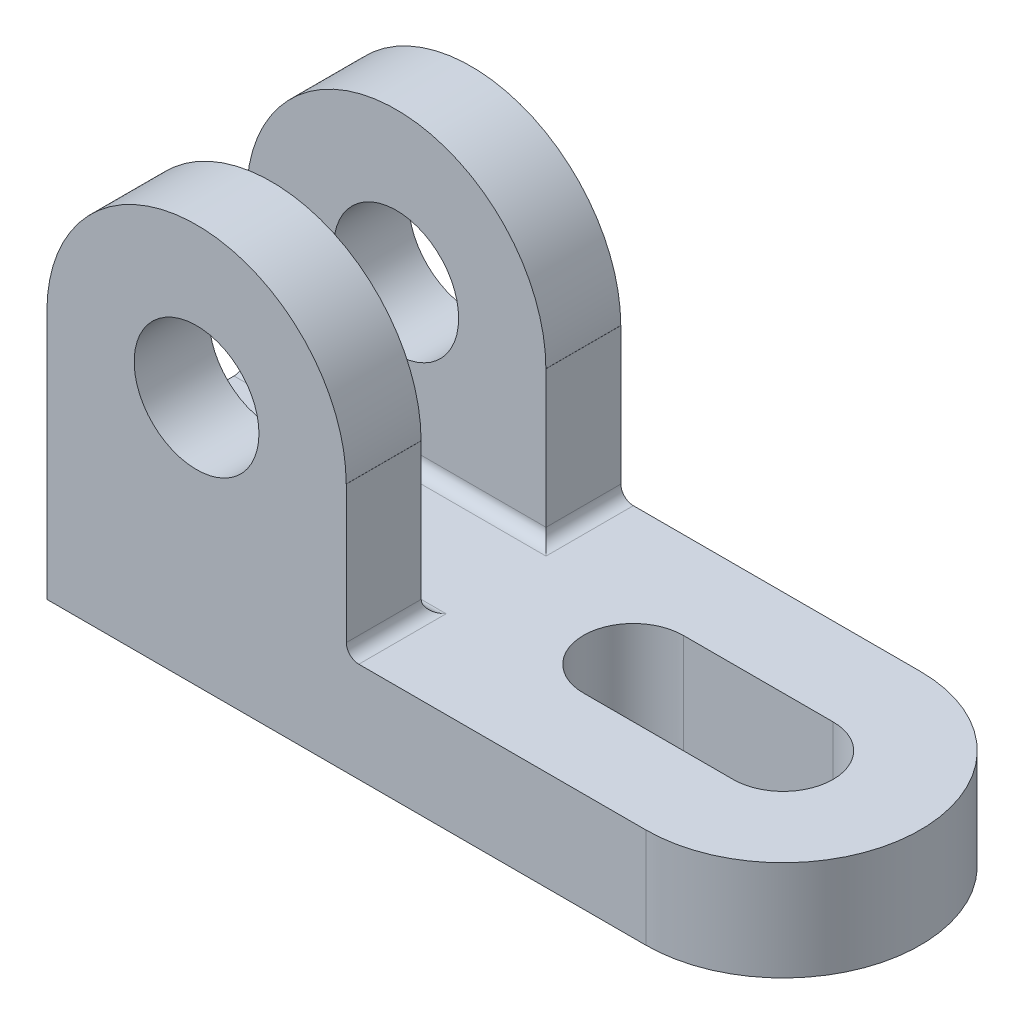
from build123d import *

# Parameters (mm, degrees)
SKETCH3_R           = 22
BOSS_EXTRUDE1_DEPTH = 16
CUT_EXTRUDE1_DEPTH  = 16
BOSS_EXTRUDE2_DEPTH = 12
FILLET1_R           = 2


with BuildPart() as part:
    # Sketch3 → Boss-Extrude1 (new body)
    with BuildSketch(Plane(origin=(0, 0, 0), x_dir=(1, 0, 0), z_dir=(0, 1, 0))):
        with BuildLine():
            Line((-59, -22), (37, -22))
            ThreePointArc((37, -22), (15, 0), (37, 22))
            Line((37, 22), (-59, 22))
            Line((-59, 22), (-59, -22))
        make_face()
        with Locations((37, 0)):
            Circle(SKETCH3_R)
    extrude(amount=BOSS_EXTRUDE1_DEPTH)

    # Sketch4 → Cut-Extrude1 (cut)
    with BuildSketch(Plane(origin=(0, 16, 0), x_dir=(1, 0, 0), z_dir=(0, 1, 0))):
        with BuildLine():
            Line((37, -8), (13, -8))
            ThreePointArc((13, -8), (5, 0), (13, 8))
            Line((13, 8), (37, 8))
            ThreePointArc((37, 8), (45, 0), (37, -8))
        make_face()
    extrude(amount=-CUT_EXTRUDE1_DEPTH, mode=Mode.SUBTRACT)

    # Sketch5 → Boss-Extrude2 (add)
    with BuildSketch(Plane.XY.offset(22)):
        with BuildLine():
            Line((-59, 40), (-59, 16))
            Line((-59, 16), (-11, 16))
            Line((-11, 16), (-11, 40))
            Line((-11, 40), (-11.018613653, 40))
            ThreePointArc((-11.018613653, 40), (-35, 16.018613653), (-58.981386347, 40))
            Line((-58.981386347, 40), (-59, 40))
        make_face()
        with BuildLine():
            ThreePointArc((-11.018613653, 40), (-35, 63.981386347), (-58.981386347, 40))
            Line((-58.981386347, 40), (-45, 40))
            ThreePointArc((-45, 40), (-35, 50), (-25, 40))
            Line((-25, 40), (-11.018613653, 40))
        make_face()
        with BuildLine():
            Line((-45, 40), (-58.981386347, 40))
            ThreePointArc((-58.981386347, 40), (-35, 16.018613653), (-11.018613653, 40))
            Line((-11.018613653, 40), (-25, 40))
            ThreePointArc((-25, 40), (-35, 30), (-45, 40))
        make_face()
    boss_extrude2 = extrude(amount=-BOSS_EXTRUDE2_DEPTH)

    # Mirror1: Boss-Extrude2 across plane
    add(boss_extrude2.mirror(Plane.XY))

    # Fillet1
    fillet1_edges = [part.edges().sort_by_distance(p)[0] for p in [
        (-11, 16, 16),
        (-35, 16, 10),
        (-35, 16, -10),
        (-11, 16, -16),
    ]]
    fillet(fillet1_edges, radius=FILLET1_R)


solid = part.part
